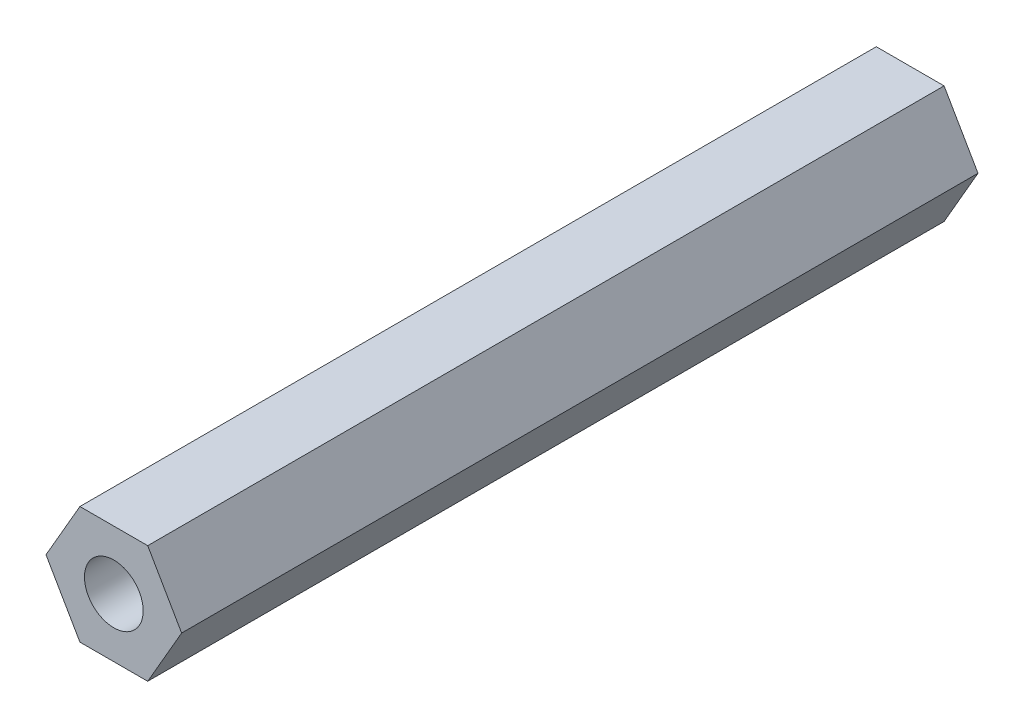
from build123d import *

# Parameters (mm, degrees)
SKETCH1_R           = 3.175
BOSS_EXTRUDE1_DEPTH = 43.053


with BuildPart() as part:
    # Sketch1 → Boss-Extrude1 (new, symmetric)
    with BuildSketch(Plane.XY):
        Polygon((3.666174209, 6.35), (-3.666174209, 6.35), (-7.332348419, 0), (-3.666174209, -6.35), (3.666174209, -6.35), (7.332348419, 0), align=None)
        Circle(SKETCH1_R, mode=Mode.SUBTRACT)
    extrude(amount=BOSS_EXTRUDE1_DEPTH, both=True)


solid = part.part
